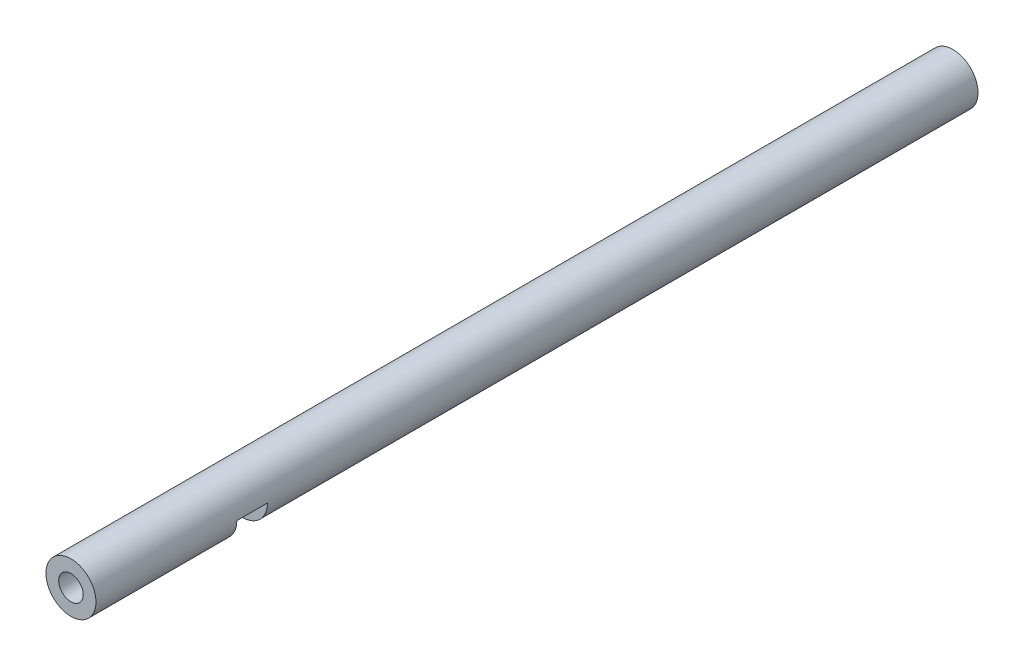
from build123d import *

# Parameters (mm, degrees)
SKETCH1_R           = 6.477
SKETCH1_R_2         = 3.175
BOSS_EXTRUDE1_DEPTH = 228.6
SKETCH2_W           = 12.954
SKETCH2_H           = 7.9375
CUT_EXTRUDE1_DEPTH  = 229.783441398


with BuildPart() as part:
    # Sketch1 → Boss-Extrude1 (new body)
    with BuildSketch(Plane.XY):
        Circle(SKETCH1_R)
        Circle(SKETCH1_R_2, mode=Mode.SUBTRACT)
    extrude(amount=BOSS_EXTRUDE1_DEPTH)

    # Sketch2 → Cut-Extrude1 (cut, through all)
    with BuildSketch(Plane(origin=(0, 0, 0), x_dir=(1, 0, 0), z_dir=(0, 1, 0))):
        with Locations((0, -188.11875)):
            Rectangle(SKETCH2_W, SKETCH2_H)
    extrude(amount=-CUT_EXTRUDE1_DEPTH, mode=Mode.SUBTRACT)


solid = part.part
